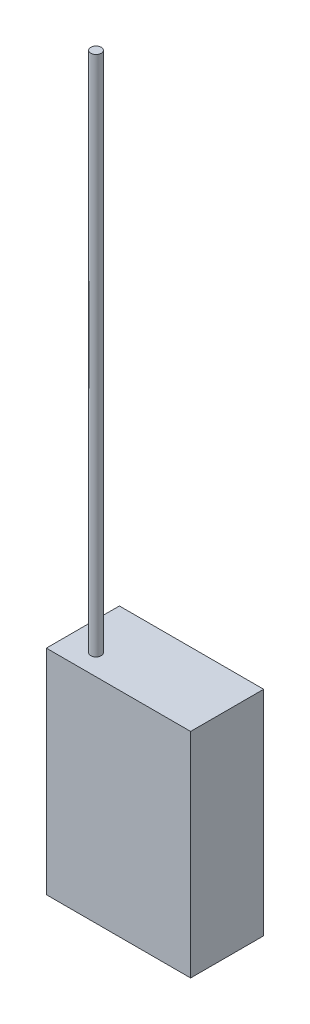
from build123d import *

# Parameters (mm, degrees)
SKETCH1_W           = 13.826897396
SKETCH1_H           = 20.463808146
BOSS_EXTRUDE1_DEPTH = 7
SKETCH2_R           = 0.5
BOSS_EXTRUDE2_DEPTH = 50


with BuildPart() as part:
    # Sketch1 → Boss-Extrude1 (new body)
    with BuildSketch(Plane.XY):
        with Locations((-56.093861986, 1.78803904)):
            Rectangle(SKETCH1_W, SKETCH1_H)
    extrude(amount=BOSS_EXTRUDE1_DEPTH)

    # Sketch2 → Boss-Extrude2 (add)
    with BuildSketch(Plane(origin=(0, 12.019943113, 0), x_dir=(1, 0, 0), z_dir=(0, 1, 0))):
        with Locations(Location((-60.242895055, -5, 0), (0, 0, 90))):
            Circle(SKETCH2_R)
    extrude(amount=BOSS_EXTRUDE2_DEPTH)


solid = part.part
